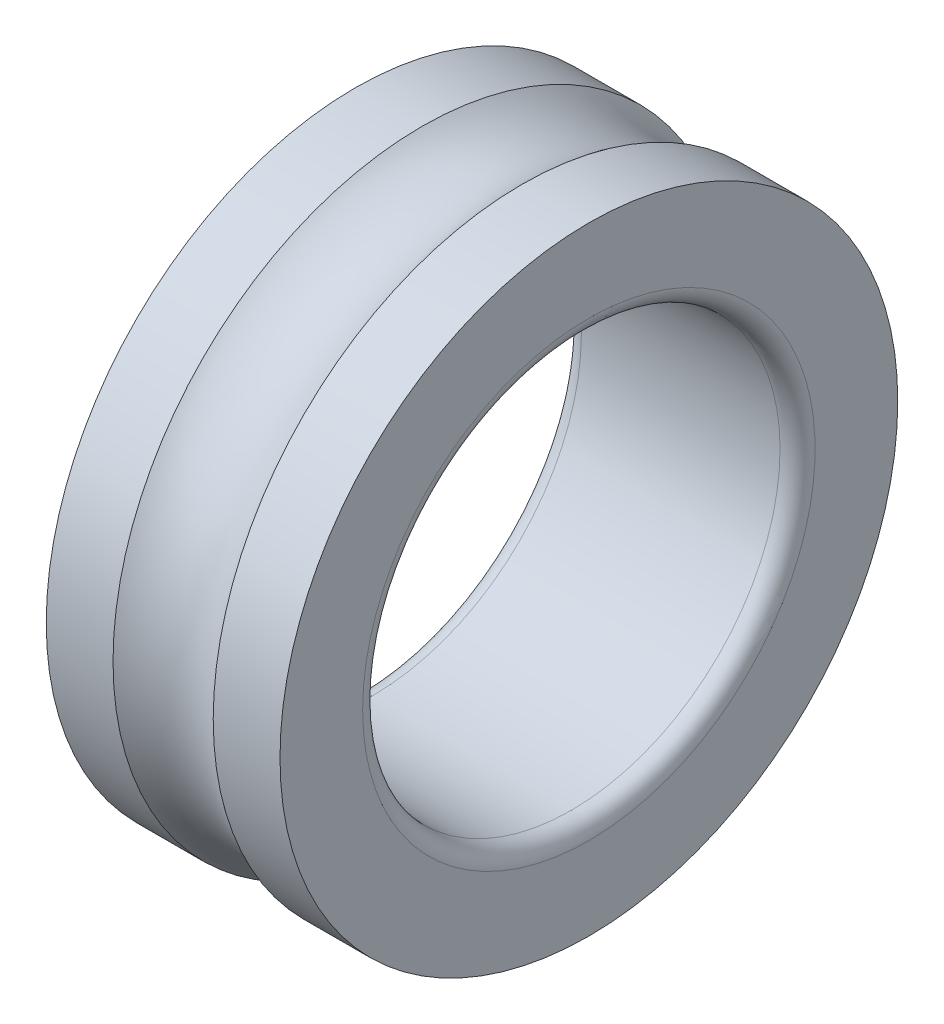
from build123d import *


with BuildPart() as part:
    # Sketch1 → Revolve1 (revolve)
    with BuildSketch(Plane.XY, mode=Mode.PRIVATE) as revolve1_sk:
        with BuildLine():
            Line((-14, 37), (-6, 37))
            ThreePointArc((-6, 37), (0, 35), (6, 37))
            Line((6, 37), (14, 37))
            Line((14, 37), (14, 27.1))
            ThreePointArc((14, 27.1), (13.38492424, 25.61507576), (11.9, 25))
            Line((11.9, 25), (-11.9, 25))
            ThreePointArc((-11.9, 25), (-13.38492424, 25.61507576), (-14, 27.1))
            Line((-14, 27.1), (-14, 37))
        make_face()
    revolve(revolve1_sk.sketch.rotate(Axis((-28.363747057, 0, 0), (1, 0, 0)), 90), axis=Axis((-28.363747057, 0, 0), (1, 0, 0)))


solid = part.part
